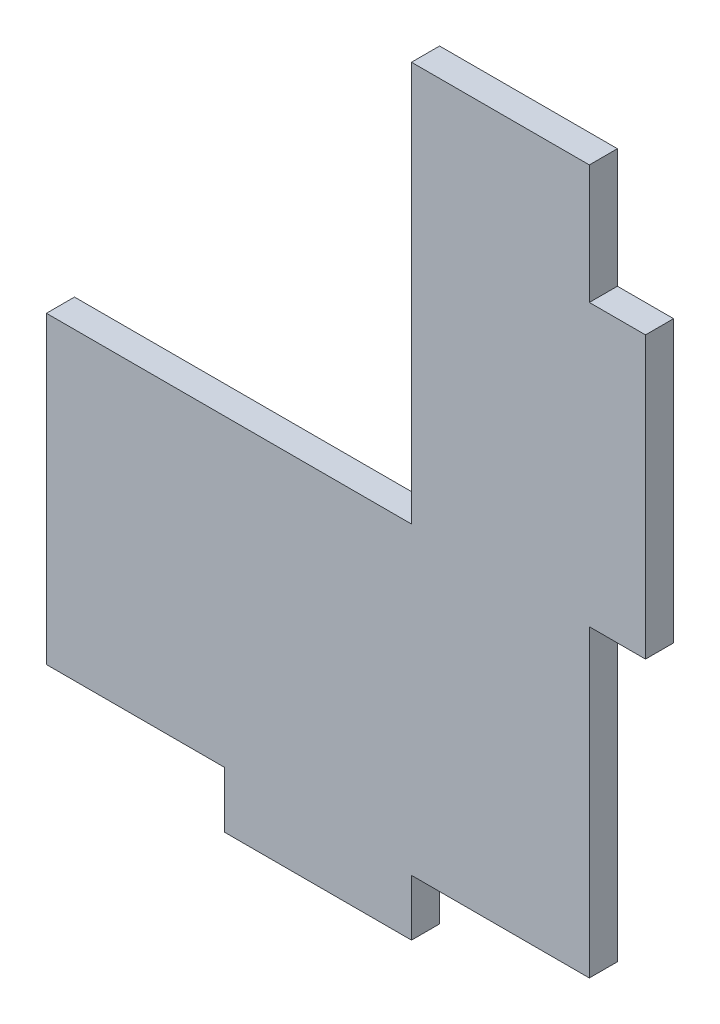
from build123d import *

# Parameters (mm, degrees)
ESQUISSE1_W             = 70
ESQUISSE1_H             = 110
BOSS_EXTRU_1_DEPTH      = 3
ENL_V_MAT_EXTRU_1_DEPTH = 131.418556962
ENL_V_MAT_EXTRU_2_DEPTH = 10


with BuildPart() as part:
    # Esquisse1 → Boss.-Extru.1 (new body)
    with BuildSketch(Plane.XY):
        with Locations((-35, 55)):
            Rectangle(ESQUISSE1_W, ESQUISSE1_H)
    extrude(amount=BOSS_EXTRU_1_DEPTH)

    # Esquisse2 → Enlèv. mat.-Extru.1 (cut, through all)
    with BuildSketch(Plane(origin=(0, 0, 0), x_dir=(-1, 0, 0), z_dir=(0, 0, -1))):
        Polygon((0, 110), (25, 110), (25, 104), (6, 104), (6, 68.5), (0, 68.5), align=None)
        Polygon((70, 110), (45, 110), (45, 104), (64, 104), (64, 68.5), (70, 68.5), align=None)
        Polygon((0, 0), (25, 0), (25, 6), (6, 6), (6, 38.5), (0, 38.5), align=None)
        Polygon((45, 0), (70, 0), (70, 38.5), (64, 38.5), (64, 6), (45, 6), align=None)
    extrude(amount=-ENL_V_MAT_EXTRU_1_DEPTH, mode=Mode.SUBTRACT)

    # Esquisse3 → Enlèv. mat.-Extru.2 (cut)
    with BuildSketch(Plane.XY.offset(3)):
        Polygon((-70, 38.5), (-25, 38.5), (-25, 81.225715449), (-2.235916109, 81.225715449), (-2.235916109, 110), (-25, 110), (-70, 110), align=None)
    extrude(amount=-ENL_V_MAT_EXTRU_2_DEPTH, mode=Mode.SUBTRACT)


solid = part.part
